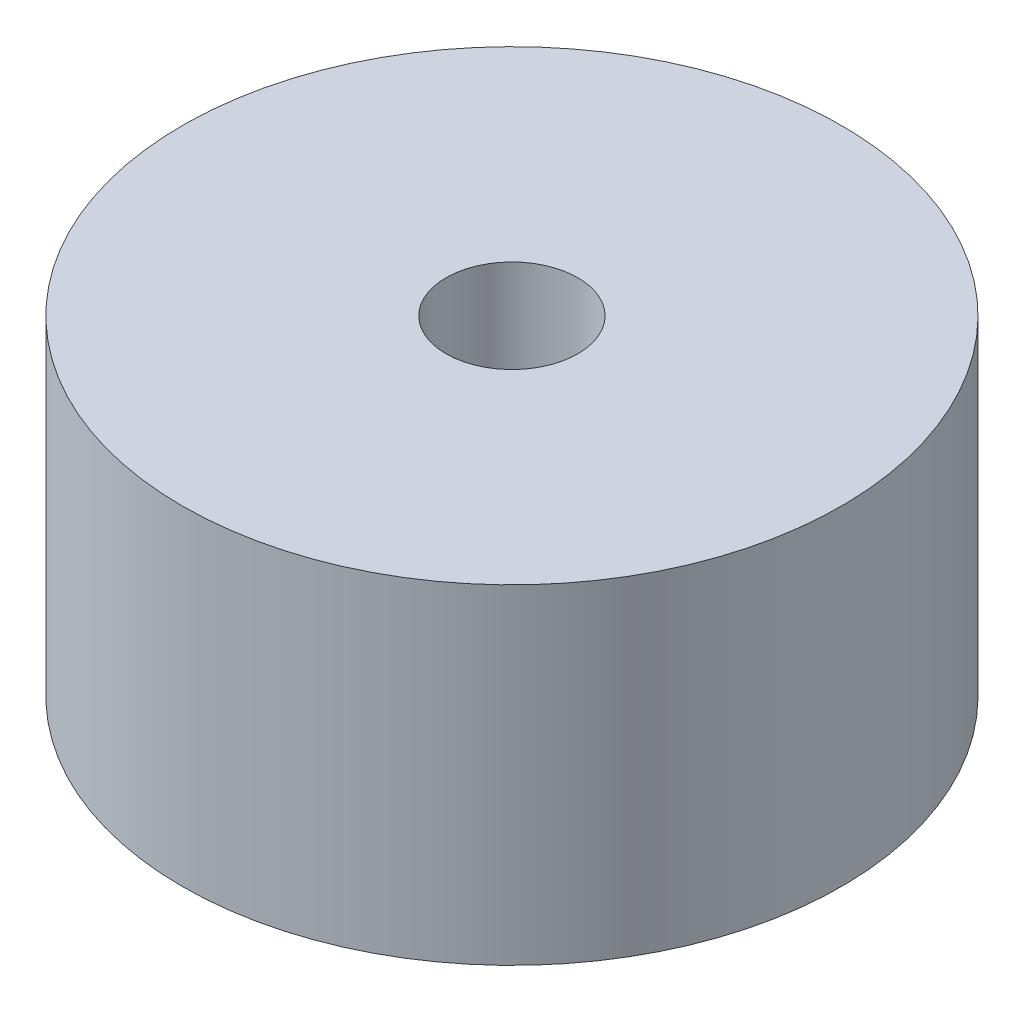
from build123d import *

# Parameters (mm, degrees)
SKETCH1_R           = 50
SKETCH1_R_2         = 10
BOSS_EXTRUDE1_DEPTH = 50


with BuildPart() as part:
    # Sketch1 → Boss-Extrude1 (new body)
    with BuildSketch(Plane(origin=(0, 0, 0), x_dir=(1, 0, 0), z_dir=(0, 1, 0))):
        with Locations(Location((0, 0, 0), (0, 0, 270))):
            Circle(SKETCH1_R)
        with Locations(Location((0, 0, 0), (0, 0, 270))):
            Circle(SKETCH1_R_2, mode=Mode.SUBTRACT)
    extrude(amount=BOSS_EXTRUDE1_DEPTH)


solid = part.part
